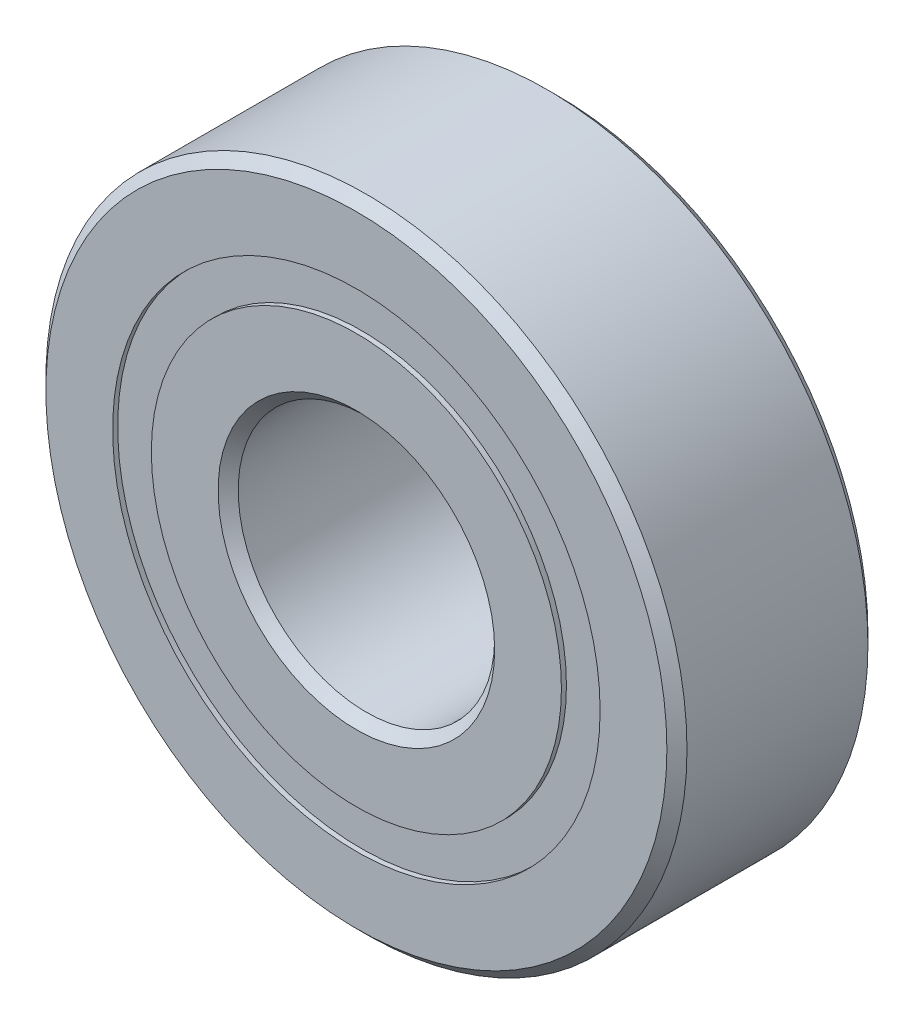
from build123d import *

# Parameters (mm, degrees)
CIRPATTERN1_COUNT = 12
SKETCH5_W         = 1.15919535
SKETCH5_H         = 0.957942858


with BuildPart() as part:
    # Sketch1 → Revolve1 (revolve)
    with BuildSketch(Plane(origin=(0, 0, 0), x_dir=(0, 0, -1), z_dir=(1, 0, 0))):
        with BuildLine():
            Line((2.24028, 7.9375), (-2.24028, 7.9375))
            Line((-2.24028, 7.9375), (-2.4892, 7.68858))
            Line((-2.4892, 7.68858), (-2.4892, 6.035221429))
            Line((-2.4892, 6.035221429), (-1.106311111, 6.035221429))
            ThreePointArc((-1.106311111, 6.035221429), (0, 6.76179465), (1.106311111, 6.035221429))
            Line((1.106311111, 6.035221429), (2.4892, 6.035221429))
            Line((2.4892, 6.035221429), (2.4892, 7.68858))
            Line((2.4892, 7.68858), (2.24028, 7.9375))
        make_face()
    revolve(axis=Axis((0, 0, 2.4892), (0, 0, -1)))


with BuildPart() as body_2:
    # Sketch3 → Revolve3 (revolve)
    with BuildSketch(Plane(origin=(0, 0, 0), x_dir=(0, 0, -1), z_dir=(1, 0, 0))):
        with BuildLine():
            Line((-1.106311111, 5.077278571), (-2.4892, 5.077278571))
            Line((-2.4892, 5.077278571), (-2.4892, 3.42392))
            Line((-2.4892, 3.42392), (-2.24028, 3.175))
            Line((-2.24028, 3.175), (2.24028, 3.175))
            Line((2.24028, 3.175), (2.4892, 3.42392))
            Line((2.4892, 3.42392), (2.4892, 5.077278571))
            Line((2.4892, 5.077278571), (1.106311111, 5.077278571))
            ThreePointArc((1.106311111, 5.077278571), (0, 4.35070535), (-1.106311111, 5.077278571))
        make_face()
    revolve(axis=Axis((0, 0, 2.4892), (0, 0, -1)))


with BuildPart() as body_3:
    # Sketch4 → Revolve4 (revolve)
    with BuildSketch(Plane(origin=(0, 0, 0), x_dir=(0, 0, -1), z_dir=(1, 0, 0))):
        with BuildLine():
            Line((-1.20554465, 5.55625), (1.20554465, 5.55625))
            ThreePointArc((1.20554465, 5.55625), (0, 6.76179465), (-1.20554465, 5.55625))
        make_face()
    revolve(axis=Axis((0, 5.55625, 1.20554465), (0, 0, -1)))


with BuildPart() as cirpattern1_1:
    # CirPattern1: pattern copy
    add(body_3.part.rotate(Axis((0, 0, -2.4892), (0, 0, 1)), 1 * 360 / CIRPATTERN1_COUNT))


with BuildPart() as cirpattern1_2:
    # CirPattern1: pattern copy
    add(body_3.part.rotate(Axis((0, 0, -2.4892), (0, 0, 1)), 2 * 360 / CIRPATTERN1_COUNT))


with BuildPart() as cirpattern1_3:
    # CirPattern1: pattern copy
    add(body_3.part.rotate(Axis((0, 0, -2.4892), (0, 0, 1)), 3 * 360 / CIRPATTERN1_COUNT))


with BuildPart() as cirpattern1_4:
    # CirPattern1: pattern copy
    add(body_3.part.rotate(Axis((0, 0, -2.4892), (0, 0, 1)), 4 * 360 / CIRPATTERN1_COUNT))


with BuildPart() as cirpattern1_5:
    # CirPattern1: pattern copy
    add(body_3.part.rotate(Axis((0, 0, -2.4892), (0, 0, 1)), 5 * 360 / CIRPATTERN1_COUNT))


with BuildPart() as cirpattern1_6:
    # CirPattern1: pattern copy
    add(body_3.part.rotate(Axis((0, 0, -2.4892), (0, 0, 1)), 6 * 360 / CIRPATTERN1_COUNT))


with BuildPart() as cirpattern1_7:
    # CirPattern1: pattern copy
    add(body_3.part.rotate(Axis((0, 0, -2.4892), (0, 0, 1)), 7 * 360 / CIRPATTERN1_COUNT))


with BuildPart() as cirpattern1_8:
    # CirPattern1: pattern copy
    add(body_3.part.rotate(Axis((0, 0, -2.4892), (0, 0, 1)), 8 * 360 / CIRPATTERN1_COUNT))


with BuildPart() as cirpattern1_9:
    # CirPattern1: pattern copy
    add(body_3.part.rotate(Axis((0, 0, -2.4892), (0, 0, 1)), 9 * 360 / CIRPATTERN1_COUNT))


with BuildPart() as cirpattern1_10:
    # CirPattern1: pattern copy
    add(body_3.part.rotate(Axis((0, 0, -2.4892), (0, 0, 1)), 10 * 360 / CIRPATTERN1_COUNT))


with BuildPart() as cirpattern1_11:
    # CirPattern1: pattern copy
    add(body_3.part.rotate(Axis((0, 0, -2.4892), (0, 0, 1)), 11 * 360 / CIRPATTERN1_COUNT))


with BuildPart() as body_15:
    # Sketch5 → Revolve5 (revolve)
    with BuildSketch(Plane(origin=(0, 0, 0), x_dir=(0, 0, -1), z_dir=(1, 0, 0))):
        with Locations((-1.785142325, 5.55625)):
            Rectangle(SKETCH5_W, SKETCH5_H)
        with Locations((1.785142325, 5.55625)):
            Rectangle(SKETCH5_W, SKETCH5_H)
    revolve(axis=Axis((0, 0, 2.4892), (0, 0, -1)))


solid = Compound([part.part, body_2.part, body_3.part, cirpattern1_1.part, cirpattern1_2.part, cirpattern1_3.part, cirpattern1_4.part, cirpattern1_5.part, cirpattern1_6.part, cirpattern1_7.part, cirpattern1_8.part, cirpattern1_9.part, cirpattern1_10.part, cirpattern1_11.part, body_15.part])
